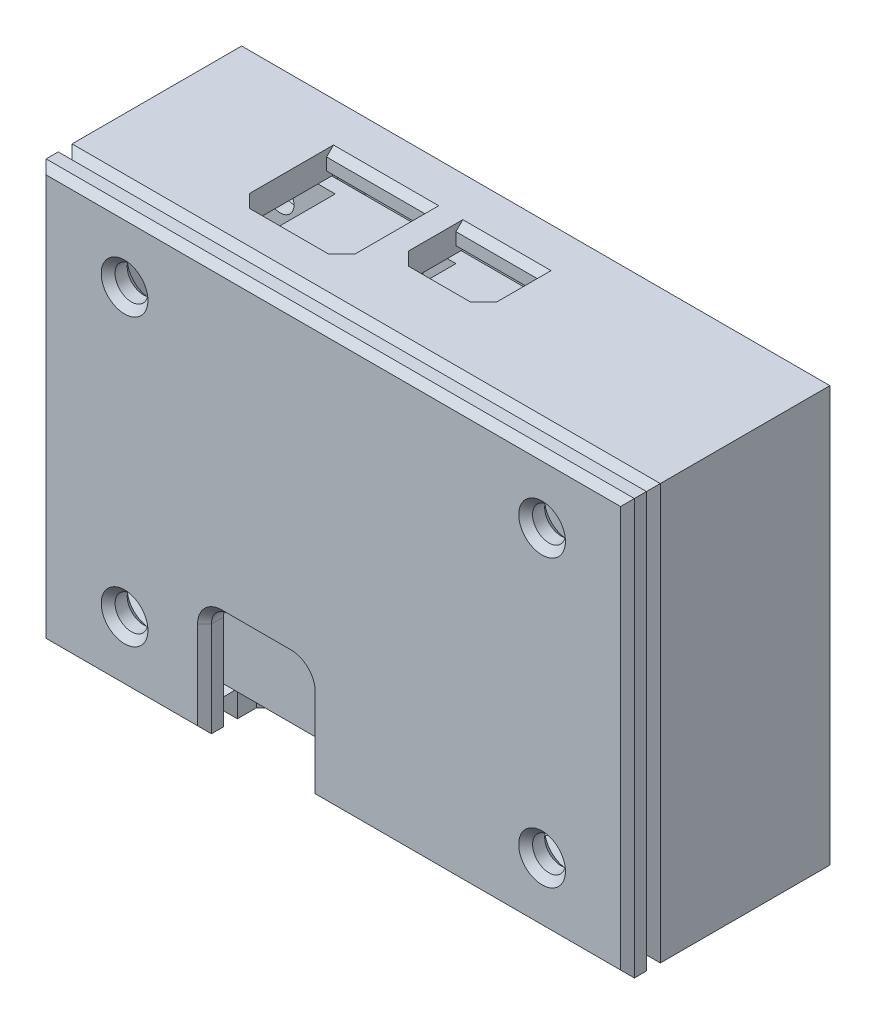
from build123d import *

# Parameters (mm, degrees)
SKETCH1_W           = 60
SKETCH1_H           = 40
SKETCH1_R           = 1.5875
BOSS_EXTRUDE1_DEPTH = 1.6
SKETCH2_W           = 9
SKETCH2_H           = 15
BOSS_EXTRUDE2_DEPTH = 11.7
SKETCH3_W           = 17.78
SKETCH3_H           = 22
BOSS_EXTRUDE3_DEPTH = 15.5
SKETCH4_W           = 10.2
SKETCH4_H           = 7.4
BOSS_EXTRUDE4_DEPTH = 10.1
SKETCH5_W           = 10.16
SKETCH5_H           = 4
BOSS_EXTRUDE5_DEPTH = 6.4
SKETCH6_W           = 68
SKETCH6_H           = 48
SKETCH6_R           = 1.35
BOSS_EXTRUDE6_DEPTH = 3
SKETCH7_W           = 68
SKETCH7_H           = 48
SKETCH7_R           = 1.35
BOSS_EXTRUDE7_DEPTH = 2
SKETCH8_W           = 68
SKETCH8_H           = 48
SKETCH8_W_2         = 62
SKETCH8_H_2         = 42
BOSS_EXTRUDE8_DEPTH = 16.6
SKETCH9_W           = 68
SKETCH9_H           = 48
SKETCH9_R           = 1.9
BOSS_EXTRUDE9_DEPTH = 3
SKETCH10_W          = 12
SKETCH10_H          = 13
CUT_EXTRUDE1_DEPTH  = 8
SKETCH11_W          = 10
SKETCH11_H          = 10
CUT_EXTRUDE2_DEPTH  = 60.708960802
CHAMFER1_SIZE       = 2
CHAMFER2_SIZE       = 2.5
SKETCH12_W          = 10.2
SKETCH12_H          = 7
CUT_EXTRUDE3_DEPTH  = 60.708960802
CHAMFER3_SIZE       = 1.5
SKETCH13_W          = 12.16
SKETCH13_H          = 10.4
CUT_EXTRUDE4_DEPTH  = 60.708960802
CHAMFER4_SIZE       = 1.5
FILLET1_R           = 2
CHAMFER5_SIZE       = 0.8
CHAMFER6_SIZE       = 1.2
CHAMFER7_SIZE       = 0.8
CHAMFER8_SIZE       = 0.8
CHAMFER9_SIZE       = 0.8
CHAMFER10_SIZE      = 1.6


with BuildPart() as part:
    # Sketch1 → Boss-Extrude1 (new body)
    with BuildSketch(Plane.XY):
        Rectangle(SKETCH1_W, SKETCH1_H)
        with Locations((-24.13, 16.51)):
            Circle(SKETCH1_R, mode=Mode.SUBTRACT)
        with Locations((-24.13, -16.51)):
            Circle(SKETCH1_R, mode=Mode.SUBTRACT)
        with Locations((24.13, -16.51)):
            Circle(SKETCH1_R, mode=Mode.SUBTRACT)
        with Locations((24.13, 16.51)):
            Circle(SKETCH1_R, mode=Mode.SUBTRACT)
    extrude(amount=BOSS_EXTRUDE1_DEPTH)

    # Sketch2 → Boss-Extrude2 (add)
    with BuildSketch(Plane.XY.offset(1.6)):
        with Locations((13.97, -12.5)):
            Rectangle(SKETCH2_W, SKETCH2_H)
    extrude(amount=BOSS_EXTRUDE2_DEPTH)

    # Sketch3 → Boss-Extrude3 (add)
    with BuildSketch(Plane.XY.offset(1.6)):
        with Locations((-8.89, -9)):
            Rectangle(SKETCH3_W, SKETCH3_H)
    extrude(amount=BOSS_EXTRUDE3_DEPTH)

    # Sketch4 → Boss-Extrude4 (add)
    with BuildSketch(Plane.XY.offset(1.6)):
        with Locations((1.27, 16.3)):
            Rectangle(SKETCH4_W, SKETCH4_H)
    extrude(amount=BOSS_EXTRUDE4_DEPTH)

    # Sketch5 → Boss-Extrude5 (add)
    with BuildSketch(Plane.XY.offset(1.6)):
        with Locations((-12.7, 18)):
            Rectangle(SKETCH5_W, SKETCH5_H)
    extrude(amount=BOSS_EXTRUDE5_DEPTH)


with BuildPart() as body_2:
    # Sketch6 → Boss-Extrude6 (new body)
    with BuildSketch(Plane(origin=(0, 0, -3), x_dir=(-1, 0, 0), z_dir=(0, 0, -1))):
        Rectangle(SKETCH6_W, SKETCH6_H)
        with Locations((-24.13, -16.51)):
            Circle(SKETCH6_R, mode=Mode.SUBTRACT)
        with Locations((-24.13, 16.51)):
            Circle(SKETCH6_R, mode=Mode.SUBTRACT)
        with Locations((24.13, 16.51)):
            Circle(SKETCH6_R, mode=Mode.SUBTRACT)
        with Locations((24.13, -16.51)):
            Circle(SKETCH6_R, mode=Mode.SUBTRACT)
        with BuildLine():
            Line((-20.5425, -20), (-20.5425, -16.51))
            ThreePointArc((-20.5425, -16.51), (-21.593254422, -13.973254422), (-24.13, -12.9225))
            Line((-24.13, -12.9225), (-30, -12.9225))
            Line((-30, -12.9225), (-31, -12.9225))
            Line((-31, -12.9225), (-31, 0))
            Line((-31, 0), (-31, 12.9225))
            Line((-31, 12.9225), (-30, 12.9225))
            Line((-30, 12.9225), (-24.13, 12.9225))
            ThreePointArc((-24.13, 12.9225), (-21.593254422, 13.973254422), (-20.5425, 16.51))
            Line((-20.5425, 16.51), (-20.5425, 20))
            Line((-20.5425, 20), (-20.5425, 21))
            Line((-20.5425, 21), (0, 21))
            Line((0, 21), (20.5425, 21))
            Line((20.5425, 21), (20.5425, 20))
            Line((20.5425, 20), (20.5425, 16.51))
            ThreePointArc((20.5425, 16.51), (21.593254422, 13.973254422), (24.13, 12.9225))
            Line((24.13, 12.9225), (30, 12.9225))
            Line((30, 12.9225), (31, 12.9225))
            Line((31, 12.9225), (31, 0))
            Line((31, 0), (31, -12.9225))
            Line((31, -12.9225), (30, -12.9225))
            Line((30, -12.9225), (24.13, -12.9225))
            ThreePointArc((24.13, -12.9225), (21.593254422, -13.973254422), (20.5425, -16.51))
            Line((20.5425, -16.51), (20.5425, -20))
            Line((20.5425, -20), (20.5425, -21))
            Line((20.5425, -21), (0, -21))
            Line((0, -21), (-20.5425, -21))
            Line((-20.5425, -21), (-20.5425, -20))
        make_face(mode=Mode.SUBTRACT)
    extrude(amount=-BOSS_EXTRUDE6_DEPTH)

    # Sketch7 → Boss-Extrude7 (add)
    with BuildSketch(Plane(origin=(0, 0, -3), x_dir=(-1, 0, 0), z_dir=(0, 0, -1))):
        Rectangle(SKETCH7_W, SKETCH7_H)
        with Locations((24.13, 16.51)):
            Circle(SKETCH7_R, mode=Mode.SUBTRACT)
        with Locations((-24.13, 16.51)):
            Circle(SKETCH7_R, mode=Mode.SUBTRACT)
        with Locations((-24.13, -16.51)):
            Circle(SKETCH7_R, mode=Mode.SUBTRACT)
        with Locations((24.13, -16.51)):
            Circle(SKETCH7_R, mode=Mode.SUBTRACT)
    extrude(amount=BOSS_EXTRUDE7_DEPTH)

    # Sketch8 → Boss-Extrude8 (add)
    with BuildSketch(Plane.XY):
        Rectangle(SKETCH8_W, SKETCH8_H)
        Rectangle(SKETCH8_W_2, SKETCH8_H_2, mode=Mode.SUBTRACT)
    extrude(amount=BOSS_EXTRUDE8_DEPTH)


with BuildPart() as body_3:
    # Sketch9 → Boss-Extrude9 (new body)
    with BuildSketch(Plane.XY.offset(16.6)):
        Rectangle(SKETCH9_W, SKETCH9_H)
        with Locations((-24.13, 16.51)):
            Circle(SKETCH9_R, mode=Mode.SUBTRACT)
        with Locations((-24.13, -16.51)):
            Circle(SKETCH9_R, mode=Mode.SUBTRACT)
        with Locations((24.13, -16.51)):
            Circle(SKETCH9_R, mode=Mode.SUBTRACT)
        with Locations((24.13, 16.51)):
            Circle(SKETCH9_R, mode=Mode.SUBTRACT)
    extrude(amount=BOSS_EXTRUDE9_DEPTH)


with BuildPart() as cut_extrude1_tool:
    # Sketch10 → Cut-Extrude1 (new body)
    with BuildSketch(Plane.XY.offset(19.6)):
        with Locations((-8.89, -17.5)):
            Rectangle(SKETCH10_W, SKETCH10_H)
    extrude(amount=-CUT_EXTRUDE1_DEPTH)


with BuildPart() as body_3_1:
    add(body_3.part)

    # Cut-Extrude1: cut by cut_extrude1_tool
    add(cut_extrude1_tool.part, mode=Mode.SUBTRACT)

    # Fillet1
    fillet1_edges = [body_3_1.edges().sort_by_distance(p)[0] for p in [
        (-14.89, -11, 18.1),
        (-2.89, -11, 18.1),
    ]]
    fillet(fillet1_edges, radius=FILLET1_R)

    # Chamfer5
    chamfer5_edges = [body_3_1.edges().sort_by_distance(p)[0] for p in [
        (-24.445, -24, 19.6),
        (-26.03, 16.51, 16.6),
        (-26.03, 16.51, 19.6),
        (34, 0, 19.6),
        (-26.03, -16.51, 16.6),
        (-26.03, -16.51, 19.6),
        (22.23, -16.51, 16.6),
        (22.23, -16.51, 19.6),
        (22.23, 16.51, 16.6),
        (22.23, 16.51, 19.6),
        (15.555, -24, 16.6),
        (15.555, -24, 19.6),
        (-2.89, -18.5, 16.6),
        (-2.89, -18.5, 19.6),
        (0, 24, 19.6),
        (34, 0, 16.6),
        (-24.445, -24, 16.6),
        (-8.89, -11, 19.6),
        (-8.89, -11, 16.6),
        (-34, 0, 16.6),
        (-14.89, -18.5, 19.6),
        (-14.89, -18.5, 16.6),
        (-3.475786438, -11.585786438, 19.6),
        (-3.475786438, -11.585786438, 16.6),
        (-14.304213562, -11.585786438, 19.6),
        (-14.304213562, -11.585786438, 16.6),
        (0, 24, 16.6),
        (-34, 0, 19.6),
    ]]
    chamfer(chamfer5_edges, length=CHAMFER5_SIZE)


with BuildPart() as body_2_1:
    add(body_2.part)

    # Cut-Extrude1: cut by cut_extrude1_tool
    add(cut_extrude1_tool.part, mode=Mode.SUBTRACT)

    # Sketch11 → Cut-Extrude2 (cut, through all)
    with BuildSketch(Plane(origin=(0, -21, 0), x_dir=(1, 0, 0), z_dir=(0, 1, 0))):
        with Locations((13.97, -8.8)):
            Rectangle(SKETCH11_W, SKETCH11_H)
    extrude(amount=-CUT_EXTRUDE2_DEPTH, mode=Mode.SUBTRACT)

    # Chamfer1
    chamfer1_edges = [body_2_1.edges().sort_by_distance(p)[0] for p in [
        (-14.89, -22.5, 11.6),
        (-2.89, -22.5, 11.6),
    ]]
    chamfer(chamfer1_edges, length=CHAMFER1_SIZE)

    # Chamfer2
    chamfer2_edges = [body_2_1.edges().sort_by_distance(p)[0] for p in [
        (18.97, -22.5, 13.8),
        (8.97, -22.5, 13.8),
    ]]
    chamfer(chamfer2_edges, length=CHAMFER2_SIZE)

    # Sketch12 → Cut-Extrude3 (cut, through all)
    with BuildSketch(Plane.XZ.offset(-21)):
        with Locations((1.27, 5.1)):
            Rectangle(SKETCH12_W, SKETCH12_H)
    extrude(amount=-CUT_EXTRUDE3_DEPTH, mode=Mode.SUBTRACT)

    # Chamfer3
    chamfer3_edges = [body_2_1.edges().sort_by_distance(p)[0] for p in [
        (6.37, 22.5, 8.6),
        (-3.83, 22.5, 8.6),
    ]]
    chamfer(chamfer3_edges, length=CHAMFER3_SIZE)

    # Sketch13 → Cut-Extrude4 (cut, through all)
    with BuildSketch(Plane.XZ.offset(-21)):
        with Locations((-12.7, 6.8)):
            Rectangle(SKETCH13_W, SKETCH13_H)
    extrude(amount=-CUT_EXTRUDE4_DEPTH, mode=Mode.SUBTRACT)

    # Chamfer4
    chamfer4_edges = [body_2_1.edges().sort_by_distance(p)[0] for p in [
        (-18.78, 22.5, 12),
        (-6.62, 22.5, 12),
    ]]
    chamfer(chamfer4_edges, length=CHAMFER4_SIZE)

    # Chamfer6
    chamfer6_edges = [body_2_1.edges().sort_by_distance(p)[0] for p in [
        (-34, 0, -5),
        (0, 24, -5),
        (34, 0, -5),
        (0, -24, -5),
        (-22.78, 16.51, -5),
        (25.48, 16.51, -5),
        (25.48, -16.51, -5),
        (-22.78, -16.51, -5),
    ]]
    chamfer(chamfer6_edges, length=CHAMFER6_SIZE)

    # Chamfer7
    chamfer7_edges = [body_2_1.edges().sort_by_distance(p)[0] for p in [
        (0, 24, 16.6),
        (-34, 0, 16.6),
        (15.555, -24, 16.6),
        (34, 0, 16.6),
        (0, 21, 16.6),
        (31, 0, 16.6),
        (14.055, -21, 16.6),
        (-31, 0, 16.6),
        (-22.945, -21, 16.6),
        (-24.445, -24, 16.6),
        (-2.89, -22.5, 16.6),
        (-14.89, -22.5, 16.6),
    ]]
    chamfer(chamfer7_edges, length=CHAMFER7_SIZE)

    # Chamfer8
    chamfer8_edges = [body_2_1.edges().sort_by_distance(p)[0] for p in [
        (13.97, -24, 3.8),
        (13.97, -21, 3.8),
        (-8.89, -21, 11.6),
        (-8.89, -24, 11.6),
        (1.27, 24, 1.6),
        (1.27, 21, 1.6),
        (-12.7, 24, 1.6),
        (-12.7, 21, 1.6),
    ]]
    chamfer(chamfer8_edges, length=CHAMFER8_SIZE)

    # Chamfer9
    chamfer9_edges = [body_2_1.edges().sort_by_distance(p)[0] for p in [
        (25.48, -16.51, 0),
        (20.5425, -18.755, 0),
        (-21.593254422, 13.973254422, 0),
        (21.593254422, -13.973254422, 0),
        (-21.593254422, -13.973254422, 0),
        (-27.565, -12.9225, 0),
        (-27.565, 12.9225, 0),
        (-20.5425, 18.755, 0),
        (20.5425, 18.755, 0),
        (21.593254422, 13.973254422, 0),
        (27.565, 12.9225, 0),
        (27.565, -12.9225, 0),
        (-22.78, -16.51, 0),
        (-20.5425, -18.755, 0),
        (-22.78, 16.51, 0),
        (25.48, 16.51, 0),
    ]]
    chamfer(chamfer9_edges, length=CHAMFER9_SIZE)

    # Chamfer10
    chamfer10_edges = [body_2_1.edges().sort_by_distance(p)[0] for p in [
        (-20.5425, -18.755, -3),
        (20.5425, -18.755, -3),
        (21.593254422, -13.973254422, -3),
        (31, 0, -3),
        (0, 21, -3),
        (-21.593254422, 13.973254422, -3),
        (-31, 0, -3),
        (0, -21, -3),
        (-21.593254422, -13.973254422, -3),
        (-27.565, -12.9225, -3),
        (-27.565, 12.9225, -3),
        (-20.5425, 18.755, -3),
        (20.5425, 18.755, -3),
        (21.593254422, 13.973254422, -3),
        (27.565, 12.9225, -3),
        (27.565, -12.9225, -3),
    ]]
    chamfer(chamfer10_edges, length=CHAMFER10_SIZE)


solid = Compound([part.part, body_3_1.part, body_2_1.part])
